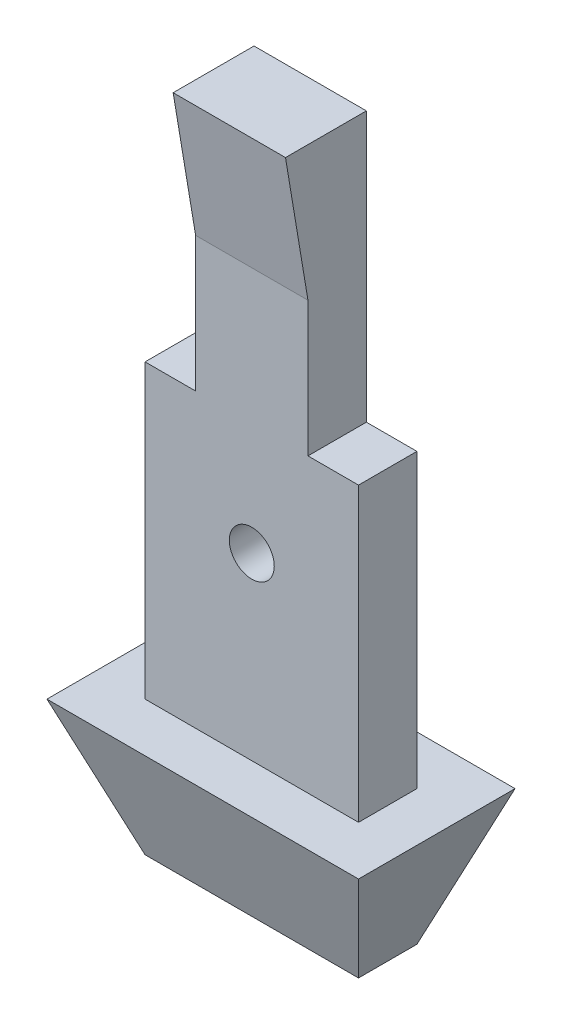
from build123d import *

# Parameters (mm, degrees)
ESBO_O1_R                = 1
RESSALTO_EXTRUS_O1_DEPTH = 2.6
ESBO_O2_W                = 9.5
ESBO_O2_H                = 2.6
RESSALTO_EXTRUS_O2_DEPTH = 6
RESSALTO_EXTRUS_O2_TAPER = -20
RESSALTO_EXTRUS_O3_DEPTH = 5


with BuildPart() as part:
    # Esboço1 → Ressalto-extrusão1 (new body)
    with BuildSketch(Plane.XY):
        Polygon((-2.5, 31), (2.5, 31), (2.5, 19), (4.75, 19), (4.75, 0), (-4.75, 0), (-4.75, 19), (-2.5, 19), align=None)
        with Locations((0, 14)):
            Circle(ESBO_O1_R, mode=Mode.SUBTRACT)
    extrude(amount=RESSALTO_EXTRUS_O1_DEPTH)

    # Esboço2 → Ressalto-extrusão2 (add)
    with BuildSketch(Plane.XZ):
        with Locations((0, 1.3)):
            Rectangle(ESBO_O2_W, ESBO_O2_H)
    extrude(amount=-RESSALTO_EXTRUS_O2_DEPTH, taper=RESSALTO_EXTRUS_O2_TAPER)

    # Esboço3 → Ressalto-extrusão3 (add)
    with BuildSketch(Plane(origin=(2.5, 0, 0), x_dir=(0, 0, -1), z_dir=(1, 0, 0))):
        Polygon((-2.6, 31), (-3.6, 31), (-2.6, 25), align=None)
    extrude(amount=-RESSALTO_EXTRUS_O3_DEPTH)


solid = part.part
